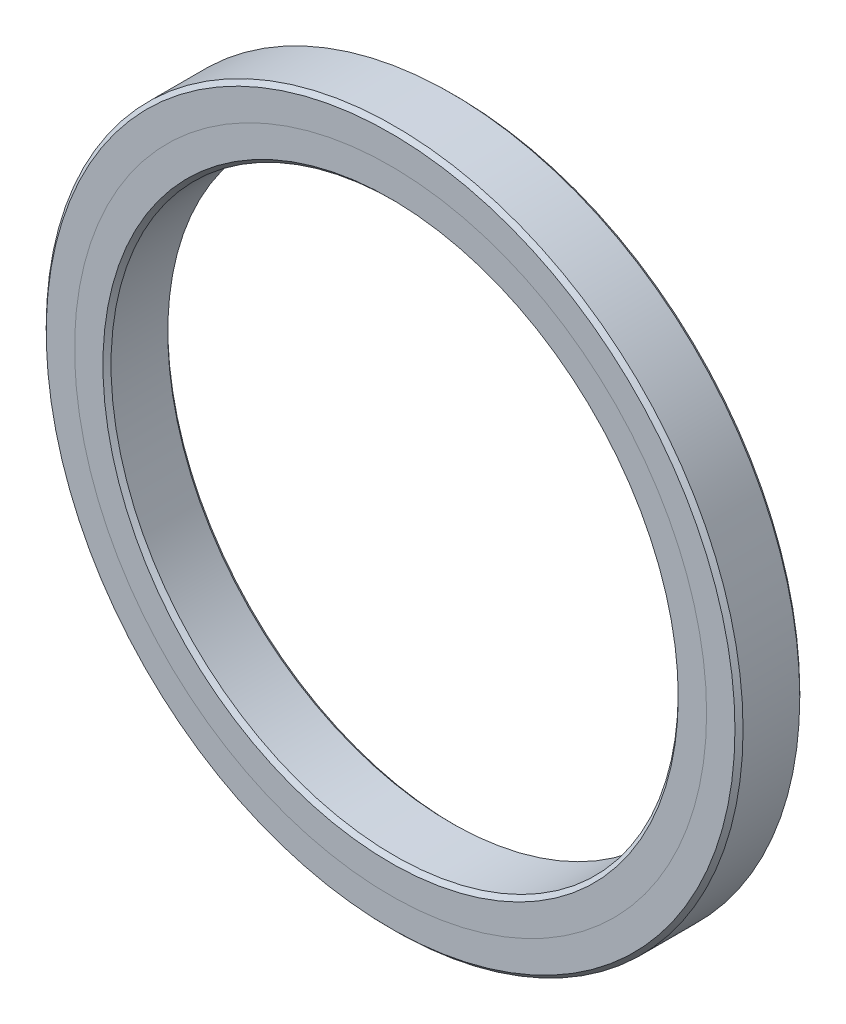
from build123d import *

# Parameters (mm, degrees)
SKETCH_1_R      = 43
SKETCH_1_R_2    = 35
EXTRUDE_1_DEPTH = 4
CHAMFER_1_SIZE  = 0.5


with BuildPart() as part:
    # 草图1 → 凸台-拉伸1 (new, symmetric)
    with BuildSketch(Plane.XY):
        Circle(SKETCH_1_R)
        Circle(SKETCH_1_R_2, mode=Mode.SUBTRACT)
    extrude(amount=EXTRUDE_1_DEPTH, both=True)

    # 倒角1
    chamfer_1_edges = [part.edges().sort_by_distance(p)[0] for p in [
        (-43, 0, -4),
        (-43, 0, 4),
        (-35, 0, -4),
        (-35, 0, 4),
    ]]
    chamfer(chamfer_1_edges, length=CHAMFER_1_SIZE)


solid = part.part
